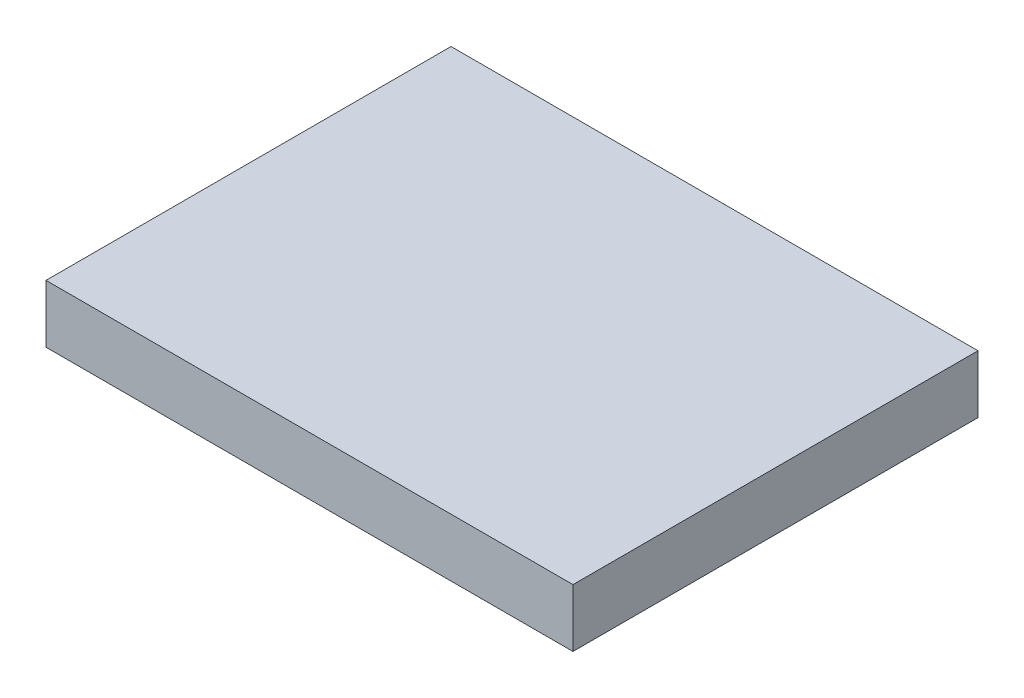
from build123d import *

# Parameters (mm, degrees)
SKETCH_1_W      = 90.966240054
SKETCH_1_H      = 69.918200466
EXTRUDE_1_DEPTH = 10


with BuildPart() as part:
    # 草图1 → 凸台-拉伸1 (new body)
    with BuildSketch(Plane(origin=(0, 0, 0), x_dir=(1, 0, 0), z_dir=(0, 1, 0))):
        Rectangle(SKETCH_1_W, SKETCH_1_H)
    extrude(amount=EXTRUDE_1_DEPTH)


solid = part.part
